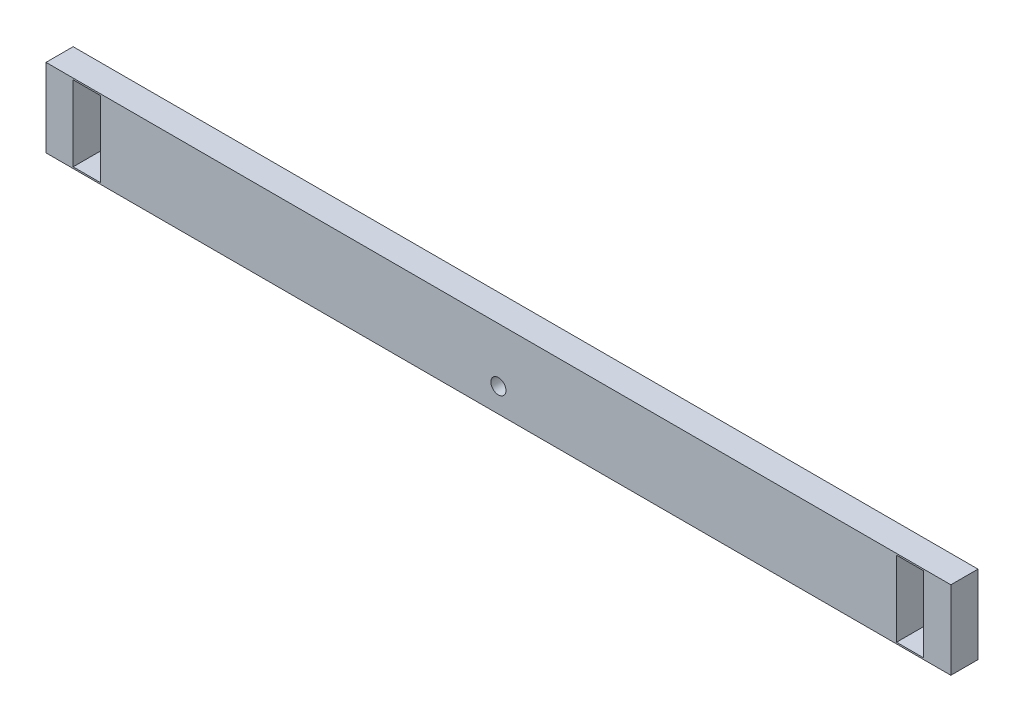
from build123d import *

# Parameters (mm, degrees)
SKETCH1_R           = 5
SKETCH1_W           = 18
SKETCH1_H           = 50
BOSS_EXTRUDE1_DEPTH = 18


with BuildPart() as part:
    # Sketch1 → Boss-Extrude1 (new body)
    with BuildSketch(Plane.XY):
        Polygon((0, 0), (600, 0), (600, -52), (307, -52), (257, -52), (0, -52), align=None)
        with Locations((300, -36)):
            Circle(SKETCH1_R, mode=Mode.SUBTRACT)
        with Locations((573, -26)):
            Rectangle(SKETCH1_W, SKETCH1_H, mode=Mode.SUBTRACT)
        with Locations((27, -26)):
            Rectangle(SKETCH1_W, SKETCH1_H, mode=Mode.SUBTRACT)
    extrude(amount=BOSS_EXTRUDE1_DEPTH)


solid = part.part
